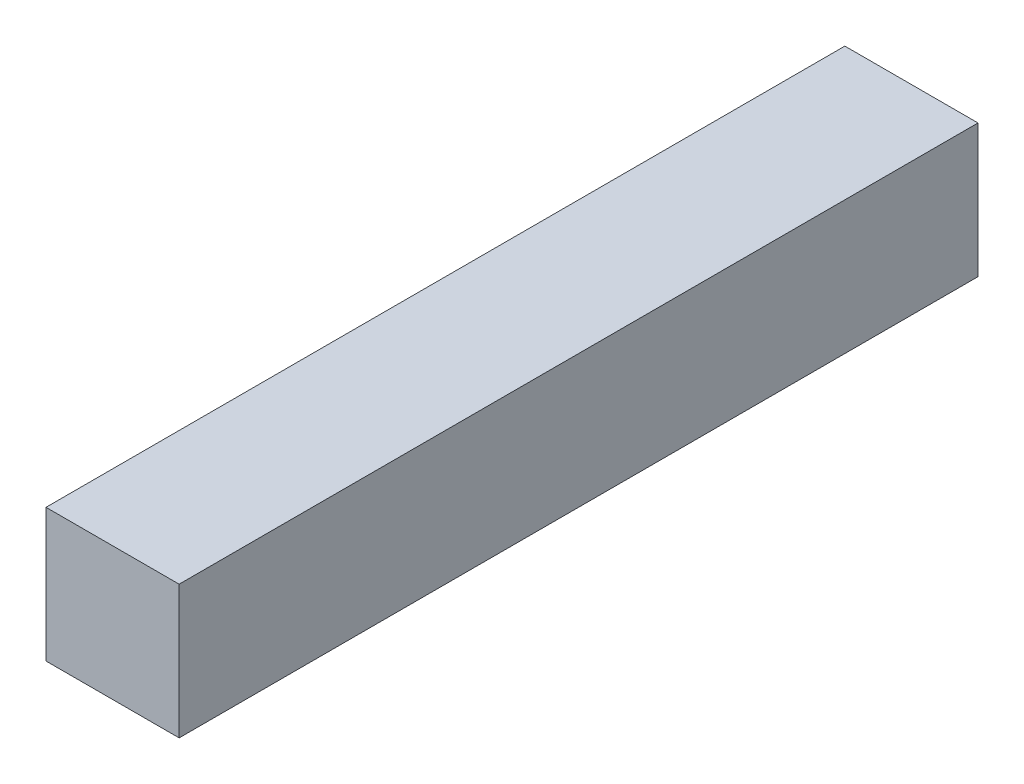
from build123d import *

# Parameters (mm, degrees)
BOSS_EXTRUDE1_DEPTH      = 9
BOSS_EXTRUDE1_DEPTH_BACK = 9
SKETCH3_W                = 3
SKETCH3_H                = 3


with BuildPart() as part:
    # Sketch3 → Boss-Extrude1 (new, two sides: drawn at the far end of the back side and taken through both)
    with BuildSketch(Plane.XY.offset(-BOSS_EXTRUDE1_DEPTH_BACK)):
        Rectangle(SKETCH3_W, SKETCH3_H)
    extrude(amount=BOSS_EXTRUDE1_DEPTH + BOSS_EXTRUDE1_DEPTH_BACK)


solid = part.part
